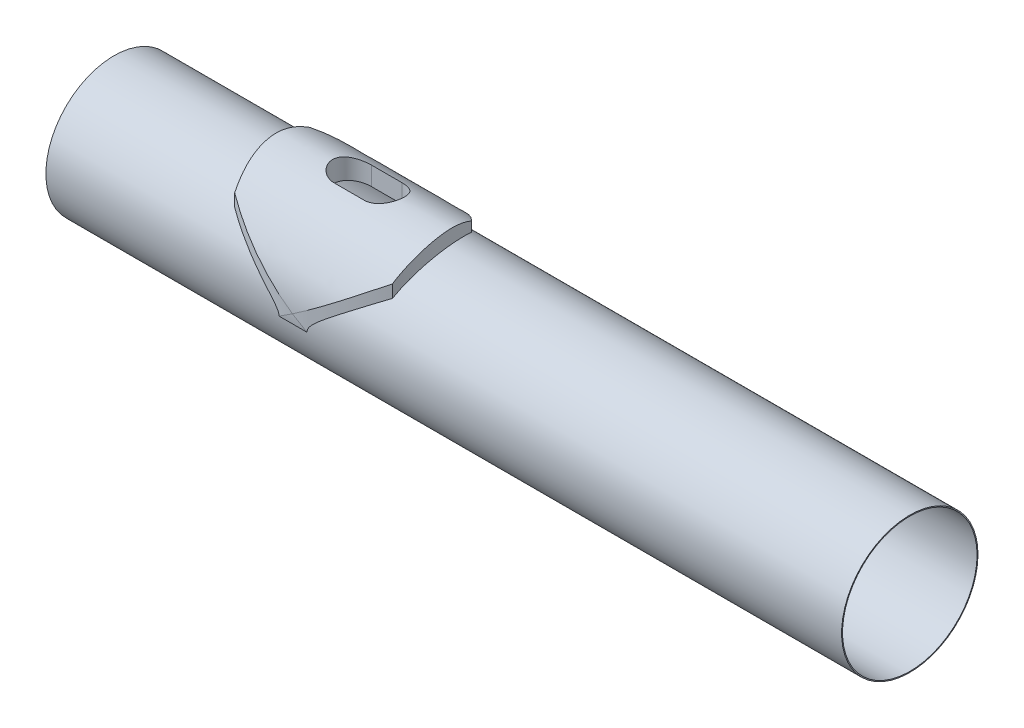
from build123d import *

# Parameters (mm, degrees)
SKETCH1_R                = 18
SKETCH1_R_2              = 17.75
BOSS_EXTRUDE1_DEPTH      = 210
BOSS_EXTRUDE2_DEPTH      = 22.5
CUT_EXTRUDE2_DEPTH       = 213.245370912
CUT_EXTRUDE12_START      = -27
CUT_EXTRUDE12_DEPTH      = 23.323952
CUT_EXTRUDE13_REACH      = 217.691
CUT_EXTRUDE13_END_RADIUS = 19.770854308
BOSS_EXTRUDE3_REACH      = 235.245
BOSS_EXTRUDE3_END_RADIUS = 18
BOSS_EXTRUDE3_START      = 21


with BuildPart() as part:
    # Sketch1 → Boss-Extrude1 (new body)
    with BuildSketch(Plane(origin=(0, 0, 0), x_dir=(0, 0, -1), z_dir=(1, 0, 0))):
        Circle(SKETCH1_R)
        Circle(SKETCH1_R_2, mode=Mode.SUBTRACT)
    extrude(amount=BOSS_EXTRUDE1_DEPTH)


with BuildPart() as body_2:
    # Sketch4 → Boss-Extrude2 (new, symmetric)
    with BuildSketch(Plane.ZY.offset(-67)):
        with BuildLine():
            ThreePointArc((-13.779943134, 14.177441493), (7.695629669, 18.21164364), (19.770854308, 0))
            add(Edge.make_bspline(
                [(-13.779943134, 14.177441493), (-10.685751008, 18.612681967), (-3.179720318, 24.881089629), (14.245409909, 21.177624873), (20.93871501, 8.550633365), (19.770854308, 0)],
                knots=[0, 0, 0, 0, 0.331280275, 0.485623577, 1, 1, 1, 1], degree=3))
        make_face()
    extrude(amount=BOSS_EXTRUDE2_DEPTH, both=True)


with BuildPart() as cut_extrude2_tool:
    # Sketch2 → Cut-Extrude2 (new, through all)
    with BuildSketch(Plane(origin=(0, 0, 0), x_dir=(1, 0, 0), z_dir=(0, 1, 0))):
        with BuildLine():
            Line((63, -5), (71, -5))
            ThreePointArc((71, -5), (76, 0), (71, 5))
            Line((71, 5), (63, 5))
            ThreePointArc((63, 5), (58, 0), (63, -5))
        make_face()
    extrude(amount=CUT_EXTRUDE2_DEPTH)


with BuildPart() as part_1:
    add(part.part)

    # Cut-Extrude2: cut by cut_extrude2_tool
    add(cut_extrude2_tool.part, mode=Mode.SUBTRACT)



with BuildPart() as body_2_1:
    add(body_2.part)

    # Cut-Extrude2: cut by cut_extrude2_tool
    add(cut_extrude2_tool.part, mode=Mode.SUBTRACT)

    # Sketch7 → Cut-Extrude12 (cut)
    with BuildSketch(Plane(origin=(0, 27, 0), x_dir=(1, 0, 0), z_dir=(0, 1, 0)).offset(CUT_EXTRUDE12_START)):
        with BuildLine():
            ThreePointArc((46.185450517, -14.355615707), (44.923728597, -8.827176662), (44.5, -3.172441075))
            Line((44.5, -3.172441075), (44.5, -19.93558029))
            Line((44.5, -19.93558029), (67, -19.93558029))
            ThreePointArc((67, -19.93558029), (56.225243913, -18.516387819), (46.185450517, -14.355615707))
        make_face()
        with BuildLine():
            ThreePointArc((87.814549483, -14.355615707), (77.774756087, -18.516387819), (67, -19.93558029))
            Line((67, -19.93558029), (89.5, -19.93558029))
            Line((89.5, -19.93558029), (89.5, -3.172440538))
            ThreePointArc((89.5, -3.172440538), (89.076271443, -8.827176396), (87.814549483, -14.355615707))
        make_face()
    extrude(amount=CUT_EXTRUDE12_DEPTH, mode=Mode.SUBTRACT)

    # Cut-Extrude13: up to this cylinder (the profile starts outside it)
    cut_extrude13_end = Plane(origin=(67, 0, 0), z_dir=(1, 0, 0)) * Cylinder(CUT_EXTRUDE13_END_RADIUS, 512.063876616, mode=Mode.PRIVATE)
    # Sketch7<4> → Cut-Extrude13 (cut, up to the surface)
    with BuildSketch(Plane(origin=(0, 27, 0), x_dir=(1, 0, 0), z_dir=(0, 1, 0)), mode=Mode.PRIVATE) as cut_extrude13_sk1:
        with BuildLine():
            Line((62.018448737, 13.779943134), (44.5, 13.779943134))
            Line((44.5, 13.779943134), (44.5, -3.172441075))
            ThreePointArc((44.5, -3.172441075), (44.781644245, 1.442087549), (45.622395888, 5.98811159))
            ThreePointArc((45.622395888, 5.98811159), (53.132553103, 11.331484209), (62.018448737, 13.779943134))
        make_face()
    cut_extrude13_tool1 = extrude(cut_extrude13_sk1.sketch, amount=-CUT_EXTRUDE13_REACH, mode=Mode.PRIVATE) - cut_extrude13_end
    add(cut_extrude13_tool1.solids().sort_by_distance((48.929916, 27, -10.778916))[0], mode=Mode.SUBTRACT)
    # Sketch7<4> → Cut-Extrude13 (cut, up to the surface)
    with BuildSketch(Plane(origin=(0, 27, 0), x_dir=(1, 0, 0), z_dir=(0, 1, 0)), mode=Mode.PRIVATE) as cut_extrude13_sk2:
        with BuildLine():
            Line((89.5, 13.779943134), (71.981551263, 13.779943134))
            ThreePointArc((71.981551263, 13.779943134), (80.867446897, 11.331484209), (88.377604112, 5.98811159))
            ThreePointArc((88.377604112, 5.98811159), (89.218355722, 1.442087815), (89.5, -3.172440538))
            Line((89.5, -3.172440538), (89.5, 13.779943134))
        make_face()
    cut_extrude13_tool2 = extrude(cut_extrude13_sk2.sketch, amount=-CUT_EXTRUDE13_REACH, mode=Mode.PRIVATE) - cut_extrude13_end
    add(cut_extrude13_tool2.solids().sort_by_distance((85.070084, 27, -10.778916))[0], mode=Mode.SUBTRACT)


with BuildPart() as part_2:
    add(part_1.part)

    add(body_2_1.part)  # Boss-Extrude3 merges body 2
    # Boss-Extrude3: up to this cylinder (the profile starts outside it)
    boss_extrude3_end = Plane(origin=(67, 0, 0), z_dir=(-1, 0, 0)) * Cylinder(BOSS_EXTRUDE3_END_RADIUS, 507.49, mode=Mode.PRIVATE)
    # Sketch2<3> → Boss-Extrude3 (add, up to the surface)
    with BuildSketch(Plane(origin=(0, 0, 0), x_dir=(1, 0, 0), z_dir=(0, 1, 0)).offset(BOSS_EXTRUDE3_START), mode=Mode.PRIVATE) as boss_extrude3_sk1:
        with BuildLine():
            Line((62.5, -5.5), (71.5, -5.5))
            ThreePointArc((71.5, -5.5), (77, 0), (71.5, 5.5))
            Line((71.5, 5.5), (62.5, 5.5))
            ThreePointArc((62.5, 5.5), (57, 0), (62.5, -5.5))
        make_face()
        with BuildLine():
            ThreePointArc((71, -5), (76, 0), (71, 5))
            Line((71, 5), (63, 5))
            ThreePointArc((63, 5), (58, 0), (63, -5))
            Line((63, -5), (71, -5))
        make_face(mode=Mode.SUBTRACT)
    boss_extrude3_tool1 = extrude(boss_extrude3_sk1.sketch, amount=-BOSS_EXTRUDE3_REACH, mode=Mode.PRIVATE) - boss_extrude3_end
    add(boss_extrude3_tool1.solids().sort_by_distance((67, 21, 5.271746))[0])


solid = part_2.part
